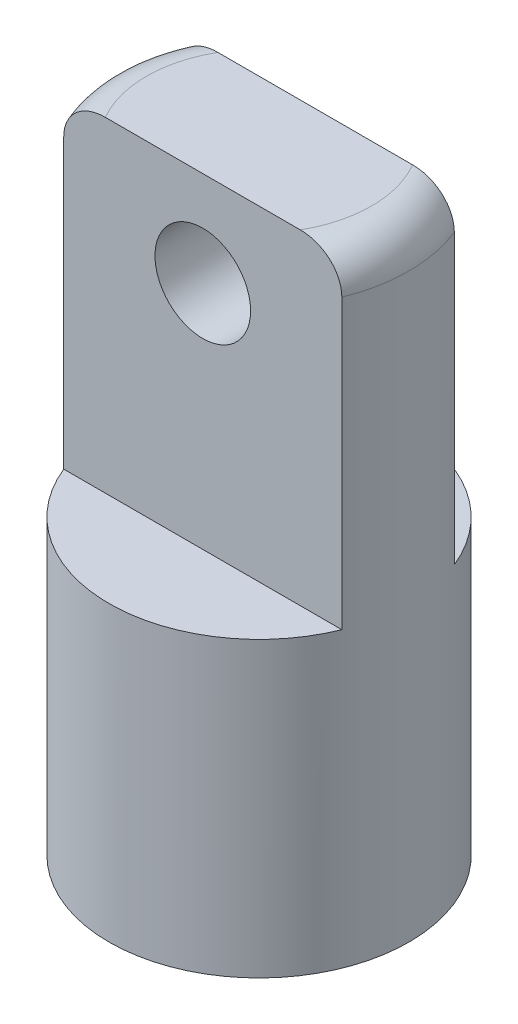
from build123d import *

# Parameters (mm, degrees)
SKETCH1_R           = 4
BOSS_EXTRUDE1_DEPTH = 16.5
CUT_EXTRUDE1_START  = -8.68
CUT_EXTRUDE1_DEPTH  = 8.68
SKETCH5_R           = 2
CUT_EXTRUDE3_DEPTH  = 7
SKETCH4_R           = 1.275
SKETCH4_R_2         = 1.27
CUT_EXTRUDE2_DEPTH  = 18.846568298
FILLET1_R           = 1


with BuildPart() as part:
    # Sketch1 → Boss-Extrude1 (new body)
    with BuildSketch(Plane(origin=(0, 0, 0), x_dir=(1, 0, 0), z_dir=(0, 1, 0))):
        with Locations(Location((0, 0, 0), (0, 0, 270))):
            Circle(SKETCH1_R)
    extrude(amount=BOSS_EXTRUDE1_DEPTH)

    # Sketch2 → Cut-Extrude1 (cut)
    with BuildSketch(Plane(origin=(0, 16.5, 0), x_dir=(1, 0, 0), z_dir=(0, 1, 0)).offset(CUT_EXTRUDE1_START)):
        with BuildLine():
            Line((-3.708099244, 1.5), (3.708099244, 1.5))
            ThreePointArc((3.708099244, 1.5), (0, 4), (-3.708099244, 1.5))
        make_face()
        with BuildLine():
            Line((-3.708099244, -1.5), (3.708099244, -1.5))
            ThreePointArc((3.708099244, -1.5), (0, -4), (-3.708099244, -1.5))
        make_face()
    extrude(amount=CUT_EXTRUDE1_DEPTH, mode=Mode.SUBTRACT)

    # Sketch5 → Cut-Extrude3 (cut)
    with BuildSketch(Plane.XZ):
        with Locations(Location((0, 0, 0), (0, 0, 270))):
            Circle(SKETCH5_R)
    extrude(amount=-CUT_EXTRUDE3_DEPTH, mode=Mode.SUBTRACT)

    # Sketch4 → Cut-Extrude2 (cut, through all)
    with BuildSketch(Plane.XY.offset(1.5)):
        with Locations((0, 13.965)):
            Circle(SKETCH4_R)
        with Locations(Location((0, 4.72, 0), (0, 0, 90))):
            Circle(SKETCH4_R_2)
    extrude(amount=-CUT_EXTRUDE2_DEPTH, mode=Mode.SUBTRACT)

    # Fillet1
    fillet1_edges = [part.edges().sort_by_distance(p)[0] for p in [
        (4, 16.5, 0),
        (-4, 16.5, 0),
    ]]
    fillet(fillet1_edges, radius=FILLET1_R)


solid = part.part
